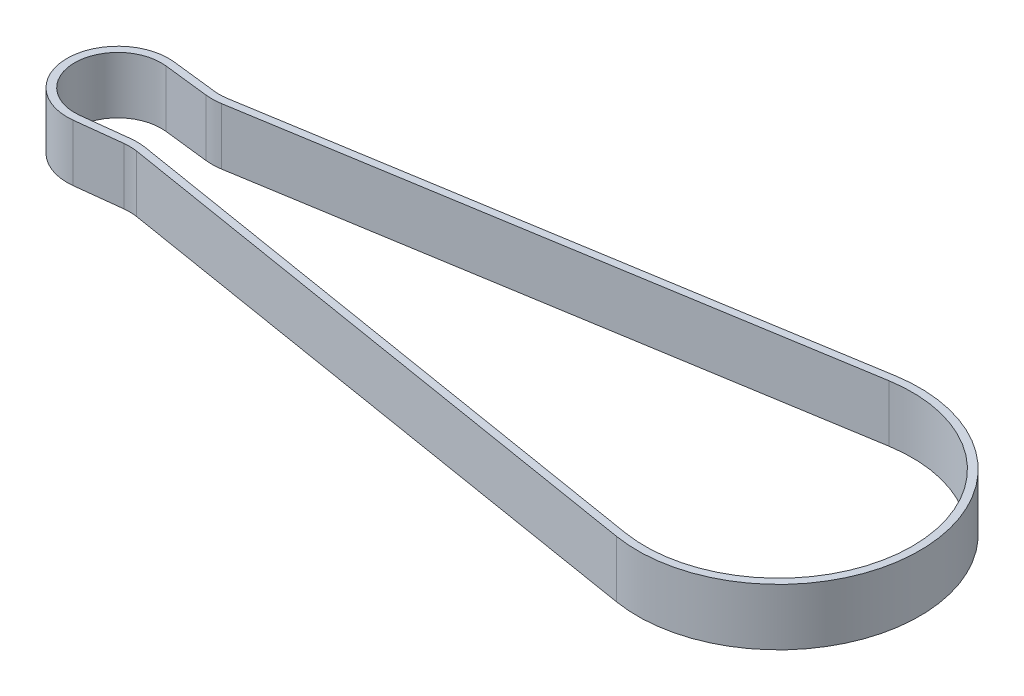
from build123d import *

# Parameters (mm, degrees)
LINEAR_AUSTRAGEN_D_NN1_DEPTH      = 3
LINEAR_AUSTRAGEN_D_NN1_DEPTH_BACK = 3


with BuildPart() as part:
    # Skizze1 → Linear-Austragen-Dünn1 (new, two sides: drawn at the far end of the back side and taken through both)
    with BuildSketch(Plane(origin=(0, 0, 0), x_dir=(1, 0, 0), z_dir=(0, 1, 0)).offset(-LINEAR_AUSTRAGEN_D_NN1_DEPTH_BACK)):
        with BuildLine():
            Line((5.425321809, 4.783135297), (0.617779056, 5.339379556))
            ThreePointArc((0.617779056, 5.339379556), (-5.375, 0), (0.617779056, -5.339379556))
            Line((0.617779056, -5.339379556), (5.425321809, -4.783135297))
            ThreePointArc((5.425321809, -4.783135297), (6.11685444, -4.751365683), (6.806147081, -4.815415227))
            Line((6.806147081, -4.815415227), (67.493650964, -14.729735548))
            ThreePointArc((67.493650964, -14.729735548), (84.825, 0), (67.493650964, 14.729735548))
            Line((67.493650964, 14.729735548), (6.806147081, 4.815415227))
            ThreePointArc((6.806147081, 4.815415227), (6.11685444, 4.751365683), (5.425321809, 4.783135297))
        make_face()
        with BuildLine():
            Line((5.333373298, 3.988436945), (0.525830545, 4.544681203))
            ThreePointArc((0.525830545, 4.544681203), (-4.575, 0), (0.525830545, -4.544681203))
            Line((0.525830545, -4.544681203), (5.333373298, -3.988436945))
            ThreePointArc((5.333373298, -3.988436945), (6.135551151, -3.951584192), (6.935130614, -4.025881663))
            Line((6.935130614, -4.025881663), (67.622634497, -13.940201984))
            ThreePointArc((67.622634497, -13.940201984), (84.025, 0), (67.622634497, 13.940201984))
            Line((67.622634497, 13.940201984), (6.935130614, 4.025881663))
            ThreePointArc((6.935130614, 4.025881663), (6.135551151, 3.951584192), (5.333373298, 3.988436945))
        make_face(mode=Mode.SUBTRACT)
    extrude(amount=LINEAR_AUSTRAGEN_D_NN1_DEPTH + LINEAR_AUSTRAGEN_D_NN1_DEPTH_BACK)


solid = part.part
